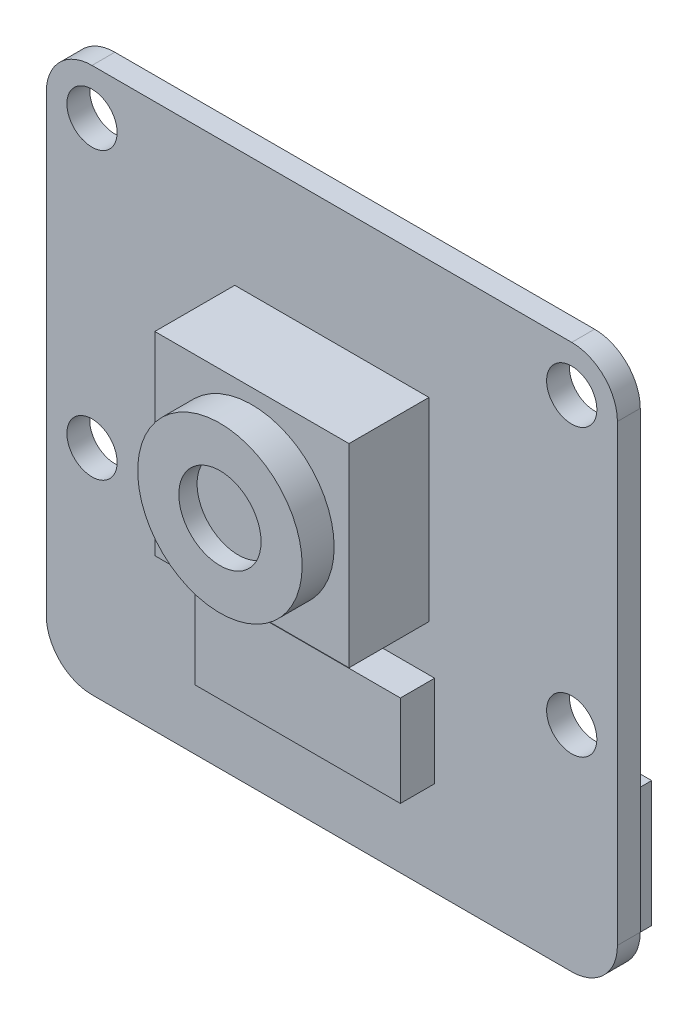
from build123d import *

# Parameters (mm, degrees)
SKETCH1_W            = 25
SKETCH1_H            = 23.862
PCB_BOARD_DEPTH      = 1
PCB_CORNER_FILLETS_R = 2
SKETCH2_R            = 1.1
MOUNTING_HOLES_DEPTH = 18.308921428
SKETCH3_W            = 8.5
SKETCH3_H            = 8.5
SENSOR_HOUSING_DEPTH = 3.5
SKETCH4_R            = 3.6
LENS_BARREL_DEPTH    = 1.4
SKETCH5_R            = 1.8
LENS_APERTURE_DEPTH  = 0.8
SKETCH6_W            = 21
SKETCH6_H            = 5.5
CSI_CONNECTOR_DEPTH  = 2.5
SKETCH7_W            = 9
SKETCH7_H            = 4
FLEX_CONNECTOR_DEPTH = 1.5


with BuildPart() as part:
    # Sketch1 → PCB_Board (new body)
    with BuildSketch(Plane.XY):
        Rectangle(SKETCH1_W, SKETCH1_H)
    extrude(amount=PCB_BOARD_DEPTH)

    # PCB_Corner_Fillets
    pcb_corner_fillets_edges = [part.edges().sort_by_distance(p)[0] for p in [
        (-12.5, 11.931, 0.5),
        (12.5, 11.931, 0.5),
        (12.5, -11.931, 0.5),
        (-12.5, -11.931, 0.5),
    ]]
    fillet(pcb_corner_fillets_edges, radius=PCB_CORNER_FILLETS_R)

    # Sketch2 → Mounting_Holes (cut, through all)
    with BuildSketch(Plane.XY.offset(1)):
        with Locations((10.5, 9.931)):
            Circle(SKETCH2_R)
        with Locations((-10.5, 9.931)):
            Circle(SKETCH2_R)
        with Locations((10.5, -2.569)):
            Circle(SKETCH2_R)
        with Locations((-10.5, -2.569)):
            Circle(SKETCH2_R)
    extrude(amount=-MOUNTING_HOLES_DEPTH, mode=Mode.SUBTRACT)

    # Sketch3 → Sensor_Housing (add)
    with BuildSketch(Plane.XY.offset(1)):
        with Locations((0, 2.469)):
            Rectangle(SKETCH3_W, SKETCH3_H)
    extrude(amount=SENSOR_HOUSING_DEPTH)

    # Sketch4 → Lens_Barrel (add)
    with BuildSketch(Plane.XY.offset(4.5)):
        with Locations((0, 2.469)):
            Circle(SKETCH4_R)
    extrude(amount=LENS_BARREL_DEPTH)

    # Sketch5 → Lens_Aperture (cut)
    with BuildSketch(Plane.XY.offset(5.9)):
        with Locations((0, 2.469)):
            Circle(SKETCH5_R)
    extrude(amount=-LENS_APERTURE_DEPTH, mode=Mode.SUBTRACT)

    # Sketch6 → CSI_Connector (add)
    with BuildSketch(Plane(origin=(0, 0, 0), x_dir=(-1, 0, 0), z_dir=(0, 0, -1))):
        with Locations((0, -9.181)):
            Rectangle(SKETCH6_W, SKETCH6_H)
    extrude(amount=CSI_CONNECTOR_DEPTH)

    # Sketch7 → Flex_Connector (add)
    with BuildSketch(Plane.XY.offset(1)):
        with Locations((0, -5.8)):
            Rectangle(SKETCH7_W, SKETCH7_H)
    extrude(amount=FLEX_CONNECTOR_DEPTH)


solid = part.part
